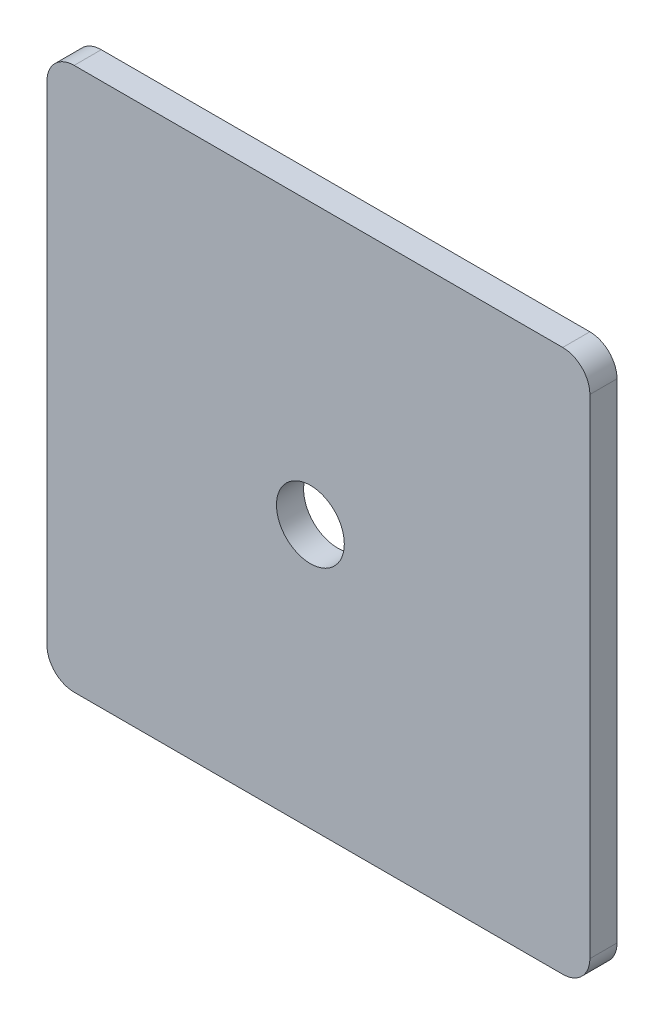
from build123d import *

# Parameters (mm, degrees)
ESQUISSE1_R        = 12.5
BOSS_EXTRU_1_DEPTH = 10


with BuildPart() as part:
    # Esquisse1 → Boss.-Extru.1 (new body)
    with BuildSketch(Plane.XY):
        with BuildLine():
            Line((-90, -100), (90, -100))
            ThreePointArc((90, -100), (97.071067812, -97.071067812), (100, -90))
            Line((100, -90), (100, 90))
            ThreePointArc((100, 90), (97.071067812, 97.071067812), (90, 100))
            Line((90, 100), (-90, 100))
            ThreePointArc((-90, 100), (-97.071067812, 97.071067812), (-100, 90))
            Line((-100, 90), (-100, -90))
            ThreePointArc((-100, -90), (-97.071067812, -97.071067812), (-90, -100))
        make_face()
        with Locations((-2.963729743, -2.963729743)):
            Circle(ESQUISSE1_R, mode=Mode.SUBTRACT)
    extrude(amount=BOSS_EXTRU_1_DEPTH)


solid = part.part
